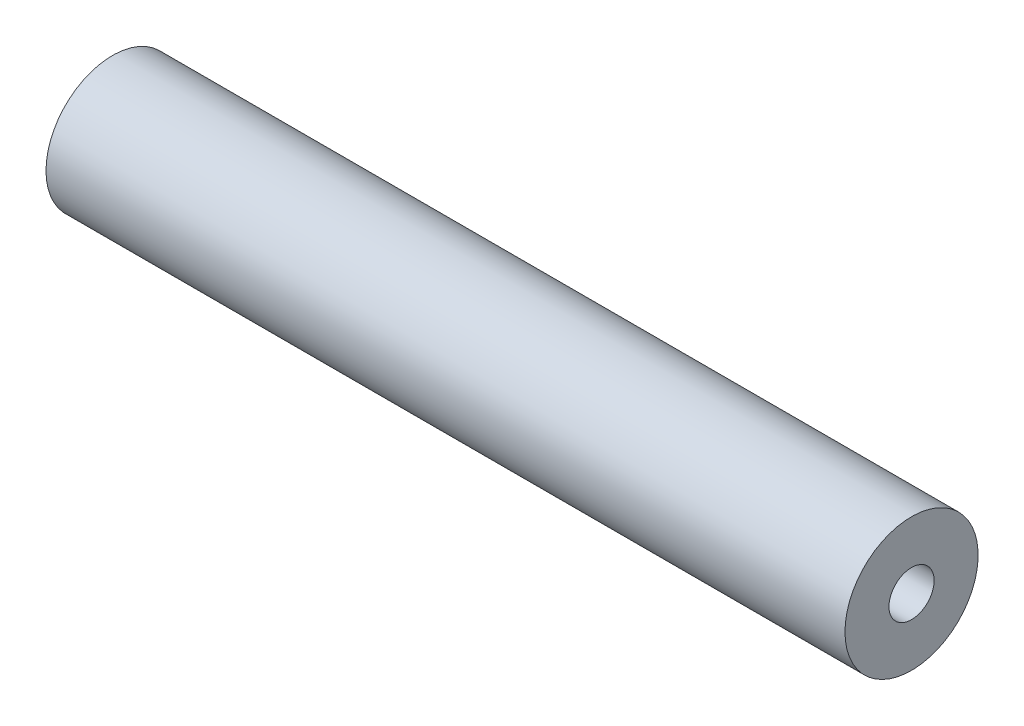
from build123d import *

# Parameters (mm, degrees)
SKETCH1_R           = 6.35
SKETCH1_R_2         = 2.15265
BOSS_EXTRUDE1_DEPTH = 76.2


with BuildPart() as part:
    # Sketch1 → Boss-Extrude1 (new body)
    with BuildSketch(Plane(origin=(0, 0, 0), x_dir=(0, 0, -1), z_dir=(1, 0, 0))):
        with Locations(Location((0, 0, 0), (0, 0, 180))):
            Circle(SKETCH1_R)
        with Locations(Location((0, 0, 0), (0, 0, 180))):
            Circle(SKETCH1_R_2, mode=Mode.SUBTRACT)
    extrude(amount=BOSS_EXTRUDE1_DEPTH)


solid = part.part
